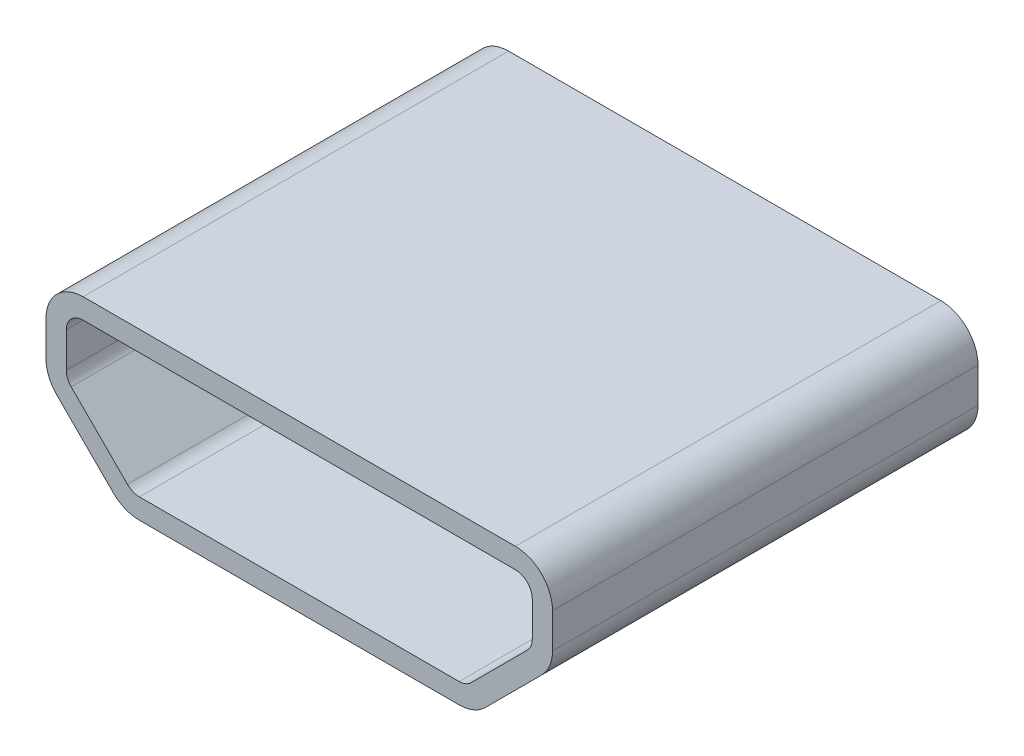
from build123d import *

# Parameters (mm, degrees)
RESSALTO_EXTRUS_O1_DEPTH = 3.15
ESBO_O2_OUTSIDE_W        = 11.52
ESBO_O2_OUTSIDE_H        = 6.47
CORTE_EXTRUS_O1_DEPTH    = 3.5


with BuildPart() as part:
    # Esboço1 → Ressalto-extrusão1 (new, symmetric)
    with BuildSketch(Plane.XY):
        with BuildLine():
            Line((3.2, 1.225), (-3.2, 1.225))
            ThreePointArc((-3.2, 1.225), (-3.58890873, 1.06390873), (-3.75, 0.675))
            Line((-3.75, 0.675), (-3.75, 0.157817459))
            ThreePointArc((-3.75, 0.157817459), (-3.708133743, -0.052658428), (-3.58890873, -0.23109127))
            Line((-3.58890873, -0.23109127), (-2.75609127, -1.06390873))
            ThreePointArc((-2.75609127, -1.06390873), (-2.577658428, -1.183133743), (-2.367182541, -1.225))
            Line((-2.367182541, -1.225), (2.367182541, -1.225))
            ThreePointArc((2.367182541, -1.225), (2.577658428, -1.183133743), (2.75609127, -1.06390873))
            Line((2.75609127, -1.06390873), (3.58890873, -0.23109127))
            ThreePointArc((3.58890873, -0.23109127), (3.708133743, -0.052658428), (3.75, 0.157817459))
            Line((3.75, 0.157817459), (3.75, 0.675))
            ThreePointArc((3.75, 0.675), (3.58890873, 1.06390873), (3.2, 1.225))
        make_face()
    extrude(amount=RESSALTO_EXTRUS_O1_DEPTH, both=True)

    # Esboço2 outside → Corte-extrusão1 (cut)
    # profile 1 of 2: a face of its own
    with BuildSketch(Plane.XY.offset(3.15)):
        Rectangle(ESBO_O2_OUTSIDE_W, ESBO_O2_OUTSIDE_H)
        with BuildLine():
            Line((2.75609127, -1.06390873), (3.58890873, -0.23109127))
            ThreePointArc((3.58890873, -0.23109127), (3.708133743, -0.052658428), (3.75, 0.157817459))
            Line((3.75, 0.157817459), (3.75, 0.675))
            ThreePointArc((3.75, 0.675), (3.58890873, 1.06390873), (3.2, 1.225))
            Line((3.2, 1.225), (-3.2, 1.225))
            ThreePointArc((-3.2, 1.225), (-3.58890873, 1.06390873), (-3.75, 0.675))
            Line((-3.75, 0.675), (-3.75, 0.157817459))
            ThreePointArc((-3.75, 0.157817459), (-3.708133743, -0.052658428), (-3.58890873, -0.23109127))
            Line((-3.58890873, -0.23109127), (-2.75609127, -1.06390873))
            ThreePointArc((-2.75609127, -1.06390873), (-2.577658428, -1.183133743), (-2.367182541, -1.225))
            Line((-2.367182541, -1.225), (2.367182541, -1.225))
            ThreePointArc((2.367182541, -1.225), (2.577658428, -1.183133743), (2.75609127, -1.06390873))
        make_face(mode=Mode.SUBTRACT)
    # profile 2 of 2: a face of its own
    with BuildSketch(Plane.XY.offset(3.15)):
        with BuildLine():
            Line((-3.45, 0.675), (-3.45, 0.157817459))
            ThreePointArc((-3.45, 0.157817459), (-3.430969883, 0.062146601), (-3.376776695, -0.018959236))
            Line((-3.376776695, -0.018959236), (-2.543959236, -0.851776695))
            ThreePointArc((-2.543959236, -0.851776695), (-2.462853399, -0.905969883), (-2.367182541, -0.925))
            Line((-2.367182541, -0.925), (2.367182541, -0.925))
            ThreePointArc((2.367182541, -0.925), (2.462853399, -0.905969883), (2.543959236, -0.851776695))
            Line((2.543959236, -0.851776695), (3.376776695, -0.018959236))
            ThreePointArc((3.376776695, -0.018959236), (3.430969883, 0.062146601), (3.45, 0.157817459))
            Line((3.45, 0.157817459), (3.45, 0.675))
            ThreePointArc((3.45, 0.675), (3.376776695, 0.851776695), (3.2, 0.925))
            Line((3.2, 0.925), (-3.2, 0.925))
            ThreePointArc((-3.2, 0.925), (-3.376776695, 0.851776695), (-3.45, 0.675))
        make_face()
    extrude(amount=-CORTE_EXTRUS_O1_DEPTH, mode=Mode.SUBTRACT)


solid = part.part
